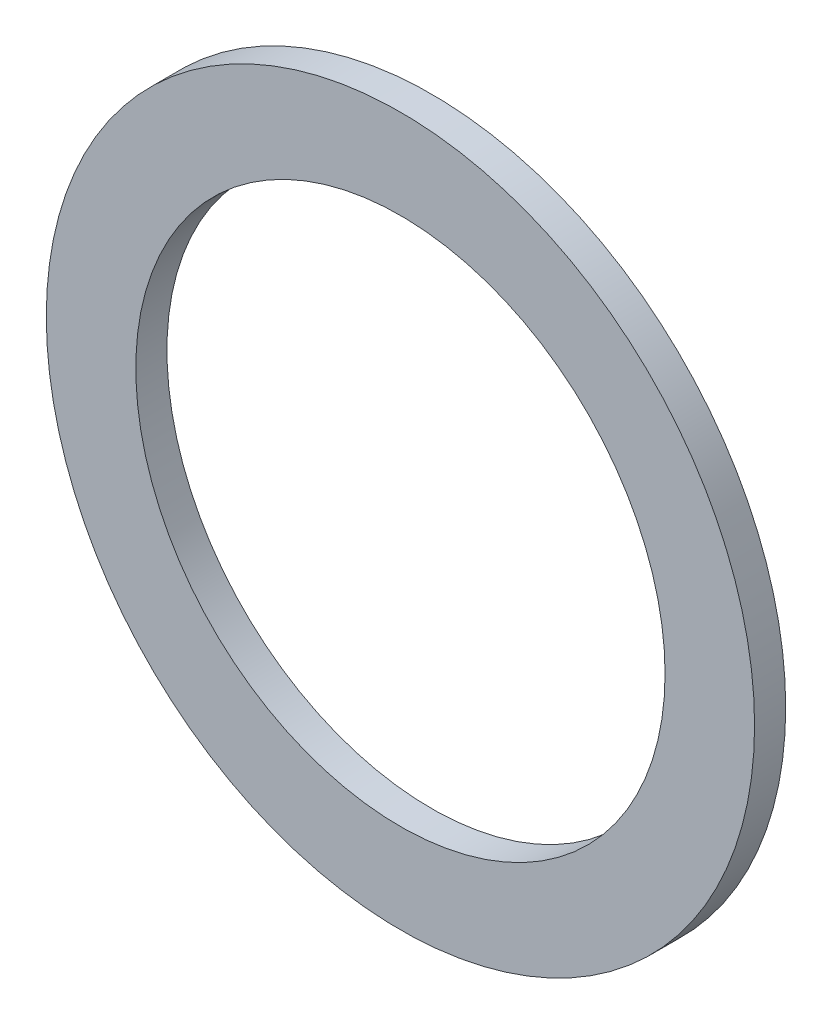
from build123d import *

# Parameters (mm, degrees)
SKETCH_1_R      = 22.75
SKETCH_1_R_2    = 17
EXTRUDE_1_DEPTH = 2


with BuildPart() as part:
    # 草圖1 → 伸長1 (new body)
    with BuildSketch(Plane.XY):
        Circle(SKETCH_1_R)
        Circle(SKETCH_1_R_2, mode=Mode.SUBTRACT)
    extrude(amount=EXTRUDE_1_DEPTH)


solid = part.part
